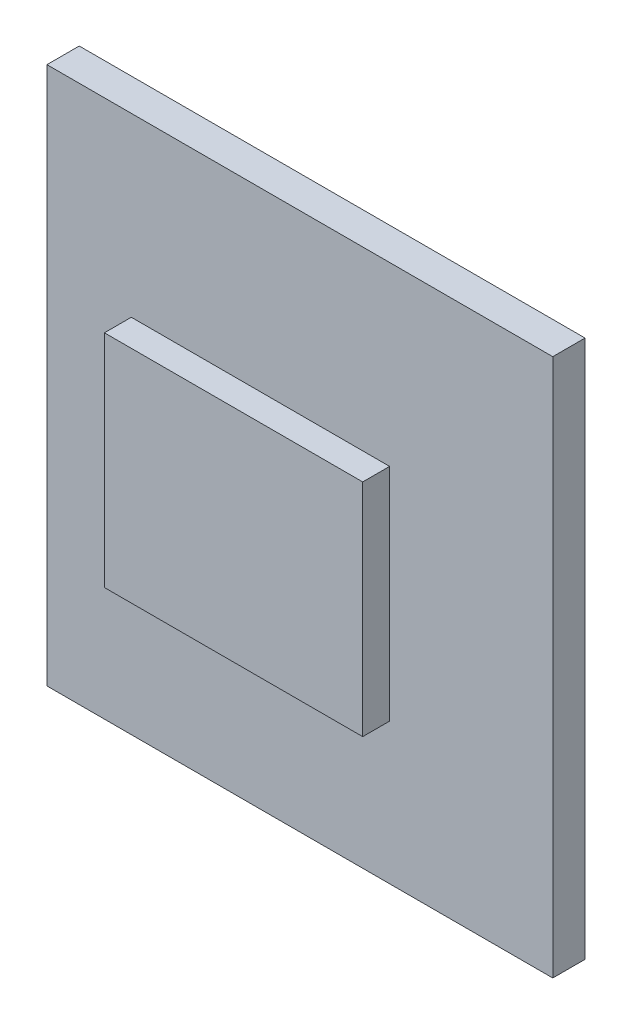
from build123d import *

# Parameters (mm, degrees)
SKETCH1_W           = 9.4
SKETCH1_H           = 10
BOSS_EXTRUDE1_DEPTH = 0.6
SKETCH2_W           = 4.8
SKETCH2_H           = 4.1
BOSS_EXTRUDE2_DEPTH = 0.5


with BuildPart() as part:
    # Sketch1 → Boss-Extrude1 (new body)
    with BuildSketch(Plane.XY):
        with Locations((4.7, 5)):
            Rectangle(SKETCH1_W, SKETCH1_H)
    extrude(amount=BOSS_EXTRUDE1_DEPTH)

    # Sketch2 → Boss-Extrude2 (add)
    with BuildSketch(Plane.XY.offset(0.6)):
        with Locations((3.967961068, 4.668237869)):
            Rectangle(SKETCH2_W, SKETCH2_H)
    extrude(amount=BOSS_EXTRUDE2_DEPTH)


solid = part.part
